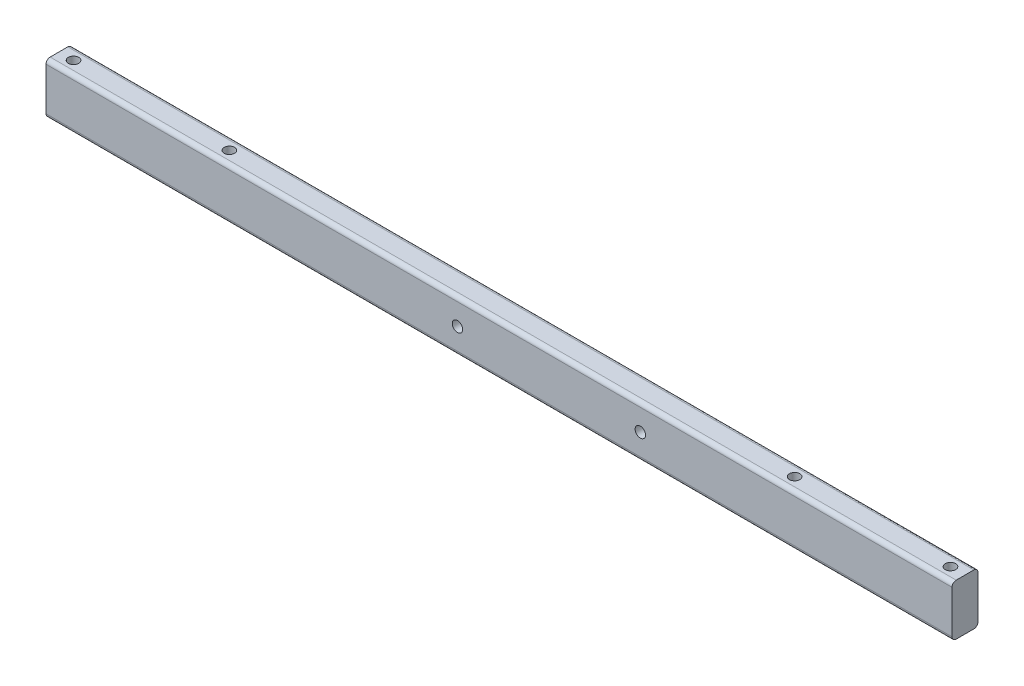
from build123d import *

# Parameters (mm, degrees)
SKETCH1_W           = 218
SKETCH1_H           = 12.3
SKETCH1_R           = 1.25
BOSS_EXTRUDE1_DEPTH = 6.25
SKETCH2_R           = 1.25
CUT_EXTRUDE1_DEPTH  = 8
FILLET1_R           = 1


with BuildPart() as part:
    # Sketch1 → Boss-Extrude1 (new body)
    with BuildSketch(Plane.XY):
        with Locations((109, 6.15)):
            Rectangle(SKETCH1_W, SKETCH1_H)
        with Locations((143, 6.15)):
            Circle(SKETCH1_R, mode=Mode.SUBTRACT)
        with Locations((99, 6.15)):
            Circle(SKETCH1_R, mode=Mode.SUBTRACT)
    extrude(amount=BOSS_EXTRUDE1_DEPTH)

    # Sketch2 → Cut-Extrude1 (cut)
    with BuildSketch(Plane(origin=(0, 12.3, 0), x_dir=(1, 0, 0), z_dir=(0, 1, 0))):
        with Locations(Location((214.5, -3.125, 0), (0, 0, 270))):
            Circle(SKETCH2_R)
        with Locations(Location((177, -3.125, 0), (0, 0, 270))):
            Circle(SKETCH2_R)
        with Locations(Location((3.5, -3.125, 0), (0, 0, 90))):
            Circle(SKETCH2_R)
        with Locations(Location((41, -3.125, 0), (0, 0, 90))):
            Circle(SKETCH2_R)
    extrude(amount=-CUT_EXTRUDE1_DEPTH, mode=Mode.SUBTRACT)

    # Fillet1
    fillet1_edges = [part.edges().sort_by_distance(p)[0] for p in [
        (109, 12.3, 6.25),
        (109, 12.3, 0),
        (109, 0, 0),
        (109, 0, 6.25),
    ]]
    fillet(fillet1_edges, radius=FILLET1_R)


solid = part.part
